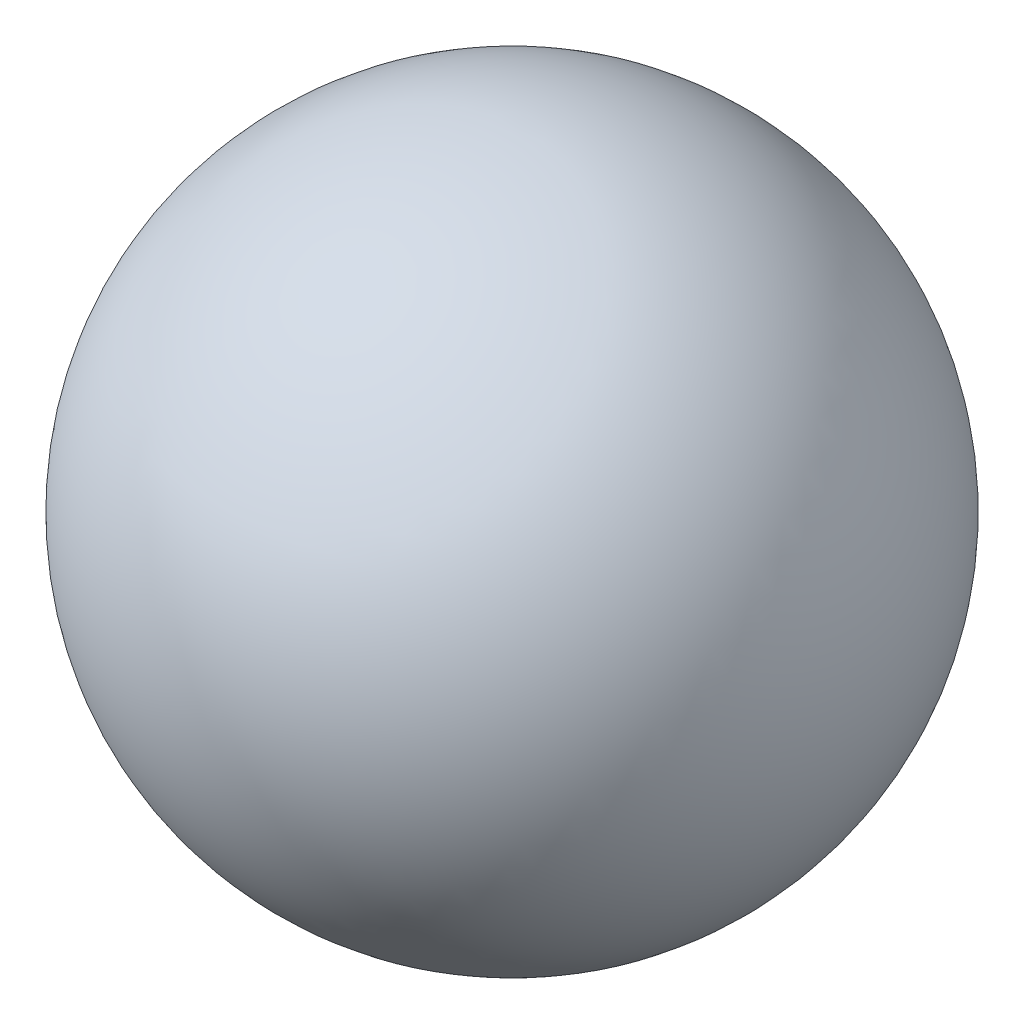
from build123d import *


with BuildPart() as part:
    # 草图1 → 旋转1 (revolve)
    with BuildSketch(Plane.XY):
        with BuildLine():
            Line((0, 7), (0, -7))
            ThreePointArc((0, -7), (7, 0), (0, 7))
        make_face()
    revolve(axis=Axis((0, 7, 0), (0, -1, 0)))


solid = part.part
